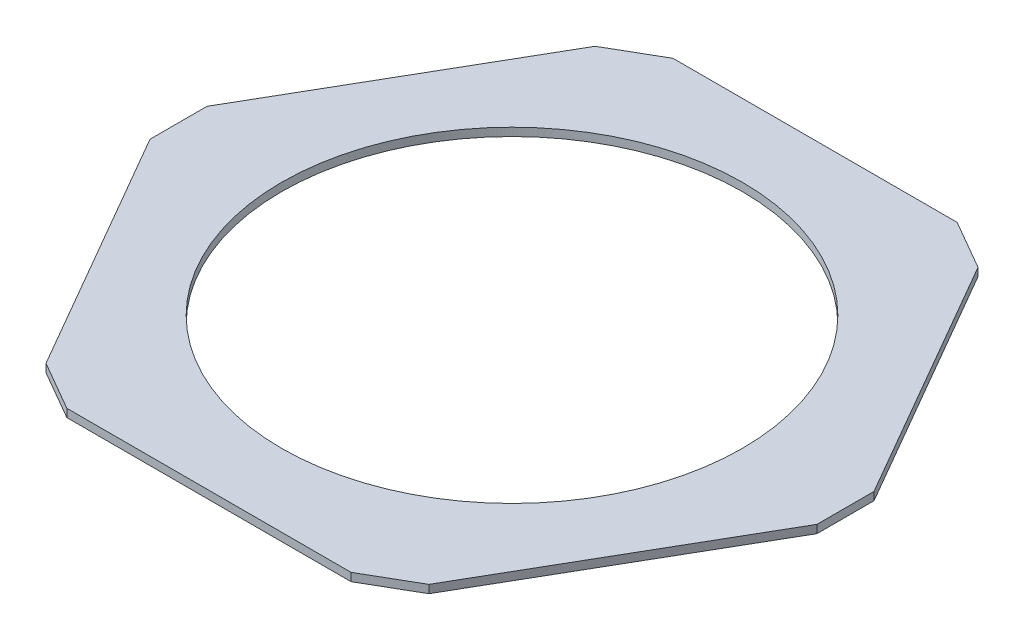
from build123d import *

# Parameters (mm, degrees)
BOSS_EXTRUDE1_DEPTH = 25
CUT_EXTRUDE4_REACH  = 1392.455
SKETCH2_R           = 710.8712965


with BuildPart() as part:
    # Sketch1 → Boss-Extrude1 (new body)
    with BuildSketch(Plane(origin=(0, 0, 0), x_dir=(1, 0, 0), z_dir=(0, 1, 0))):
        Polygon((438.317943801, 934.970880832), (590.549562699, 847.079914683), (1028.8675065, 87.89096615), (1028.8675065, -87.89096615), (590.549562699, -847.079914683), (438.317943801, -934.970880832), (-438.317943801, -934.970880832), (-590.549562699, -847.079914683), (-1028.8675065, -87.89096615), (-1028.8675065, 87.89096615), (-590.549562699, 847.079914683), (-438.317943801, 934.970880832), align=None)
    extrude(amount=BOSS_EXTRUDE1_DEPTH)

    # Sketch2 → Cut-Extrude4 (cut, up to next)
    with BuildSketch(Plane(origin=(0, 0, 0), x_dir=(1, 0, 0), z_dir=(0, 1, 0)), mode=Mode.PRIVATE) as cut_extrude4_sk1:
        with Locations(Location((0, 0, 0), (0, 0, 90))):
            Circle(SKETCH2_R)
    cut_extrude4_tool1 = extrude(cut_extrude4_sk1.sketch, amount=CUT_EXTRUDE4_REACH, mode=Mode.PRIVATE) & part.part
    add(cut_extrude4_tool1.solids().sort_by_distance((0, 0, 0))[0], mode=Mode.SUBTRACT)


solid = part.part
